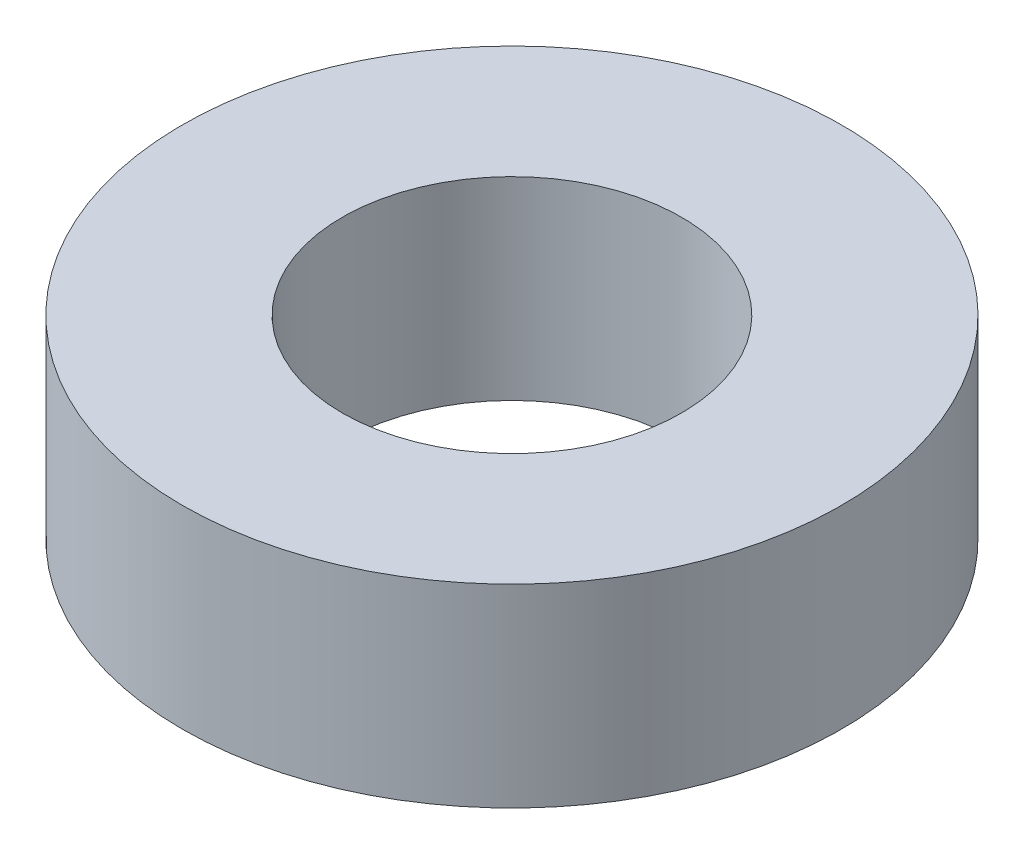
from build123d import *

# Parameters (mm, degrees)
SKETCH1_R           = 8.5
SKETCH1_R_2         = 4.375
BOSS_EXTRUDE1_DEPTH = 5


with BuildPart() as part:
    # Sketch1 → Boss-Extrude1 (new body)
    with BuildSketch(Plane(origin=(0, 0, 0), x_dir=(1, 0, 0), z_dir=(0, 1, 0))):
        with Locations(Location((0, 0, 0), (0, 0, 270))):
            Circle(SKETCH1_R)
        with Locations(Location((0, 0, 0), (0, 0, 270))):
            Circle(SKETCH1_R_2, mode=Mode.SUBTRACT)
    extrude(amount=BOSS_EXTRUDE1_DEPTH)


solid = part.part
